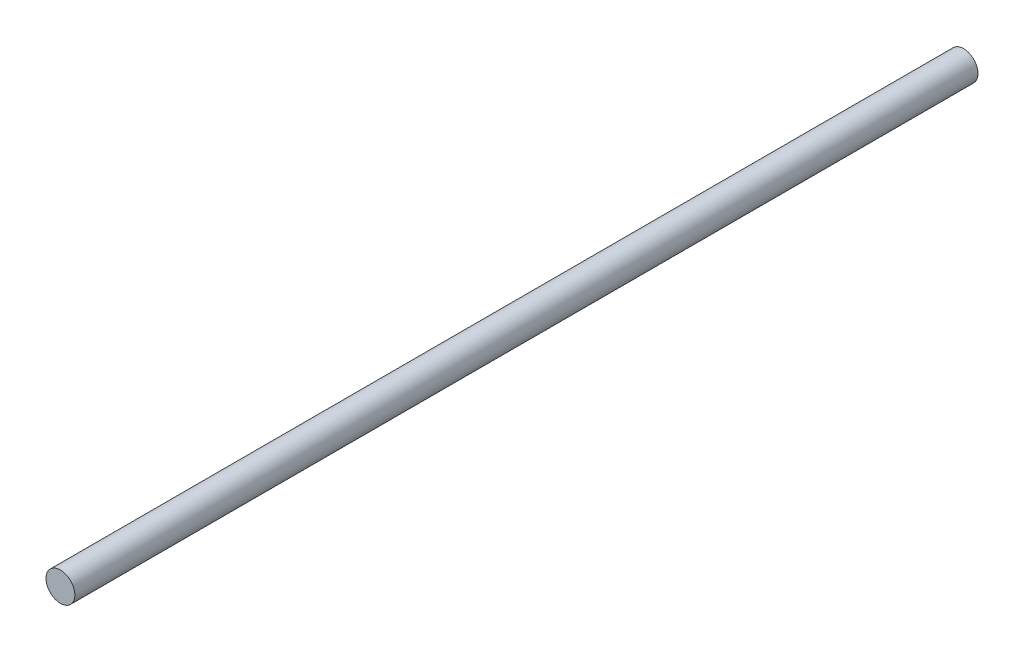
from build123d import *

# Parameters (mm, degrees)
SKETCH1_R           = 0.4064
BOSS_EXTRUDE1_DEPTH = 25.4


with BuildPart() as part:
    # Sketch1 → Boss-Extrude1 (new body)
    with BuildSketch(Plane.XY):
        Circle(SKETCH1_R)
    extrude(amount=-BOSS_EXTRUDE1_DEPTH)


solid = part.part
